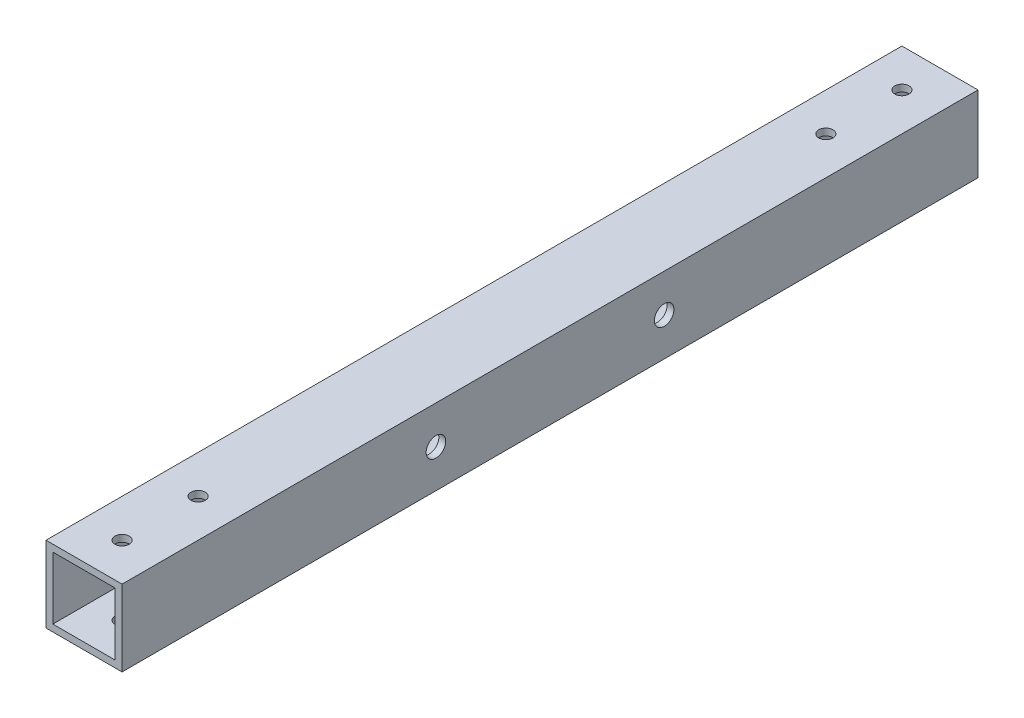
from build123d import *

# Parameters (mm, degrees)
SKETCH1_W                      = 25.4
SKETCH1_H                      = 25.4
SKETCH1_W_2                    = 20.828
SKETCH1_H_2                    = 20.828
BOSS_EXTRUDE1_DEPTH            = 285.75
F_3_16_0_1875_DIAMETER_HOLE7_D = 4.7625
F_0_257_DIAMETER_HOLE1_D       = 6.5278


with BuildPart() as part:
    # Sketch1 → Boss-Extrude1 (new body)
    with BuildSketch(Plane.XY):
        Rectangle(SKETCH1_W, SKETCH1_H)
        Rectangle(SKETCH1_W_2, SKETCH1_H_2, mode=Mode.SUBTRACT)
    extrude(amount=BOSS_EXTRUDE1_DEPTH)

    # 3/16 (0.1875) Diameter Hole7 (through all)
    with Locations(Plane(origin=(0, 12.7, 0), x_dir=(1, 0, 0), z_dir=(0, 1, 0))):
        with Locations((0, -273.05), (0, -247.65), (0, -12.7), (0, -38.1)):
            Hole(F_3_16_0_1875_DIAMETER_HOLE7_D / 2)

    # F (0.257) Diameter Hole1 (through all)
    with Locations(Plane(origin=(12.7, 0, 0), x_dir=(0, 0, -1), z_dir=(1, 0, 0))):
        with Locations((-180.975, 0), (-104.775, 0)):
            Hole(F_0_257_DIAMETER_HOLE1_D / 2)


solid = part.part
